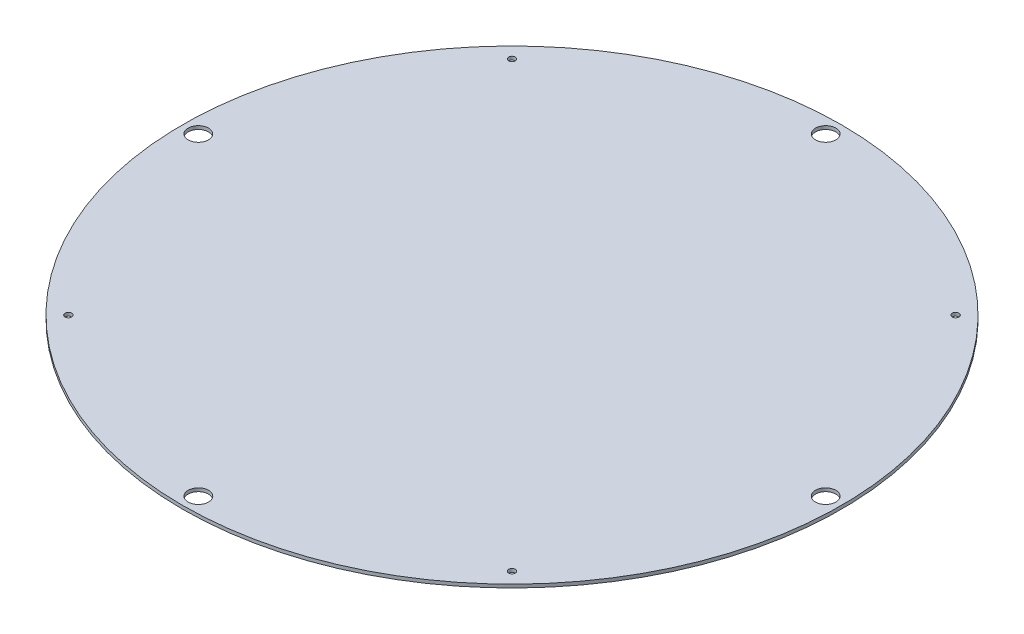
from build123d import *

# Parameters (mm, degrees)
SKETCH1_R           = 197
SKETCH1_R_2         = 6.1
SKETCH1_R_3         = 2
BOSS_EXTRUDE1_DEPTH = 2


with BuildPart() as part:
    # Sketch1 → Boss-Extrude1 (new body)
    with BuildSketch(Plane(origin=(0, 265.664131829, 0), x_dir=(1, 0, 0), z_dir=(0, 1, 0))):
        with Locations(Location((394.086664394, -1032.562454189, 0), (0, 0, 270))):
            Circle(SKETCH1_R)
        with Locations(Location((394.086664394, -845.062454189, 0), (0, 0, 270))):
            Circle(SKETCH1_R_2, mode=Mode.SUBTRACT)
        with Locations(Location((394.086664394, -1220.062454189, 0), (0, 0, 270))):
            Circle(SKETCH1_R_2, mode=Mode.SUBTRACT)
        with Locations(Location((581.586664394, -1032.562454189, 0), (0, 0, 270))):
            Circle(SKETCH1_R_2, mode=Mode.SUBTRACT)
        with Locations(Location((261.504142922, -899.979932716, 0), (0, 0, 270))):
            Circle(SKETCH1_R_3, mode=Mode.SUBTRACT)
        with Locations(Location((526.669185867, -899.979932716, 0), (0, 0, 270))):
            Circle(SKETCH1_R_3, mode=Mode.SUBTRACT)
        with Locations(Location((526.669185867, -1165.144975661, 0), (0, 0, 270))):
            Circle(SKETCH1_R_3, mode=Mode.SUBTRACT)
        with Locations(Location((261.504142922, -1165.144975661, 0), (0, 0, 270))):
            Circle(SKETCH1_R_3, mode=Mode.SUBTRACT)
        with Locations(Location((206.586664394, -1032.562454189, 0), (0, 0, 270))):
            Circle(SKETCH1_R_2, mode=Mode.SUBTRACT)
    extrude(amount=BOSS_EXTRUDE1_DEPTH)


solid = part.part
